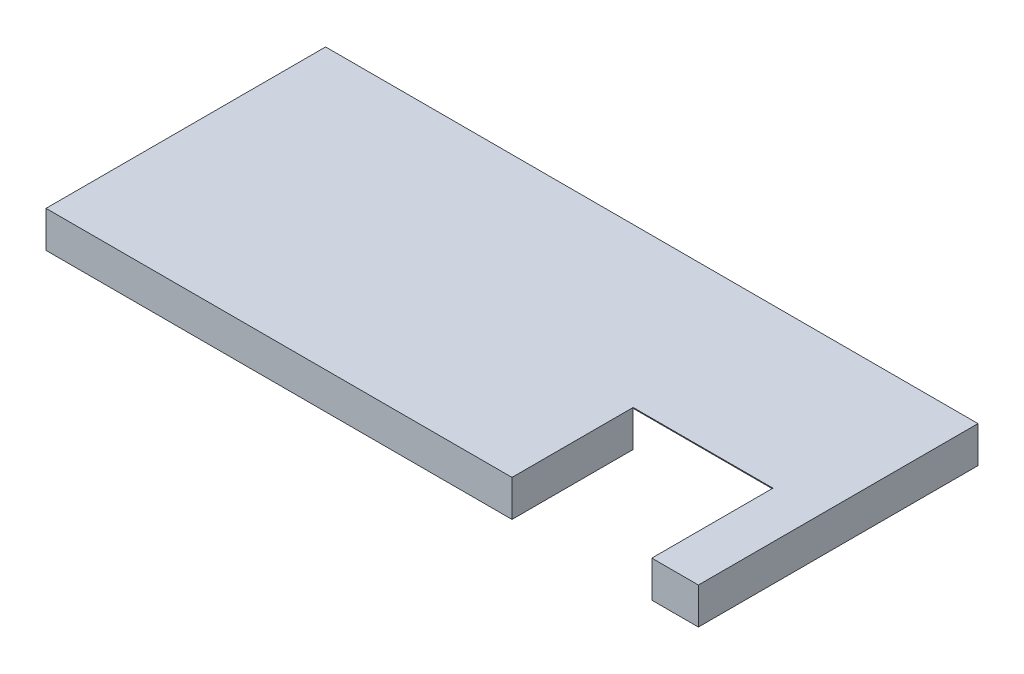
from build123d import *

# Parameters (mm, degrees)
SKETCH1_W           = 7000
SKETCH1_H           = 3000
BOSS_EXTRUDE1_DEPTH = 9
SKETCH3_W           = 1500
SKETCH3_H           = 1300
CUT_EXTRUDE1_DEPTH  = 7616.778423773
SKETCH4_W           = 5000
SKETCH4_H           = 9
BOSS_EXTRUDE2_DEPTH = 382
SKETCH5_W           = 9
SKETCH5_H           = 2991
BOSS_EXTRUDE3_DEPTH = 382
SKETCH6_W           = 6991
SKETCH6_H           = 9
BOSS_EXTRUDE4_DEPTH = 382
SKETCH7_W           = 9
SKETCH7_H           = 2991
BOSS_EXTRUDE5_DEPTH = 382
SKETCH8_W           = 491
SKETCH8_H           = 9
BOSS_EXTRUDE6_DEPTH = 382
SKETCH9_W           = 9
SKETCH9_H           = 1291
BOSS_EXTRUDE7_DEPTH = 382
SKETCH10_W          = 9
SKETCH10_H          = 1291
BOSS_EXTRUDE8_DEPTH = 382


with BuildPart() as part:
    # Sketch1 → Boss-Extrude1 (new body)
    with BuildSketch(Plane(origin=(0, 0, 0), x_dir=(1, 0, 0), z_dir=(0, 1, 0))):
        with Locations((3500, -1500)):
            Rectangle(SKETCH1_W, SKETCH1_H)
    extrude(amount=BOSS_EXTRUDE1_DEPTH)

    # Sketch3 → Cut-Extrude1 (cut, through all)
    with BuildSketch(Plane.XZ):
        with Locations((5750, 2350)):
            Rectangle(SKETCH3_W, SKETCH3_H)
    extrude(amount=-CUT_EXTRUDE1_DEPTH, mode=Mode.SUBTRACT)

    # Sketch4 → Boss-Extrude2 (add)
    with BuildSketch(Plane.XZ):
        with Locations((2500, 2995.5)):
            Rectangle(SKETCH4_W, SKETCH4_H)
    extrude(amount=BOSS_EXTRUDE2_DEPTH)

    # Sketch5 → Boss-Extrude3 (add)
    with BuildSketch(Plane.XZ):
        with Locations((4.5, 1495.5)):
            Rectangle(SKETCH5_W, SKETCH5_H)
    extrude(amount=BOSS_EXTRUDE3_DEPTH)

    # Sketch6 → Boss-Extrude4 (add)
    with BuildSketch(Plane.XZ):
        with Locations((3504.5, 4.5)):
            Rectangle(SKETCH6_W, SKETCH6_H)
    extrude(amount=BOSS_EXTRUDE4_DEPTH)

    # Sketch7 → Boss-Extrude5 (add)
    with BuildSketch(Plane.XZ):
        with Locations((6995.5, 1504.5)):
            Rectangle(SKETCH7_W, SKETCH7_H)
    extrude(amount=BOSS_EXTRUDE5_DEPTH)

    # Sketch8 → Boss-Extrude6 (add)
    with BuildSketch(Plane.XZ):
        with Locations((6745.5, 2995.5)):
            Rectangle(SKETCH8_W, SKETCH8_H)
    extrude(amount=BOSS_EXTRUDE6_DEPTH)

    # Sketch9 → Boss-Extrude7 (add)
    with BuildSketch(Plane.XZ):
        with Locations((6504.5, 2345.5)):
            Rectangle(SKETCH9_W, SKETCH9_H)
    extrude(amount=BOSS_EXTRUDE7_DEPTH)

    # Sketch10 → Boss-Extrude8 (add)
    with BuildSketch(Plane.XZ):
        with Locations((4995.5, 2345.5)):
            Rectangle(SKETCH10_W, SKETCH10_H)
    extrude(amount=BOSS_EXTRUDE8_DEPTH)


solid = part.part
